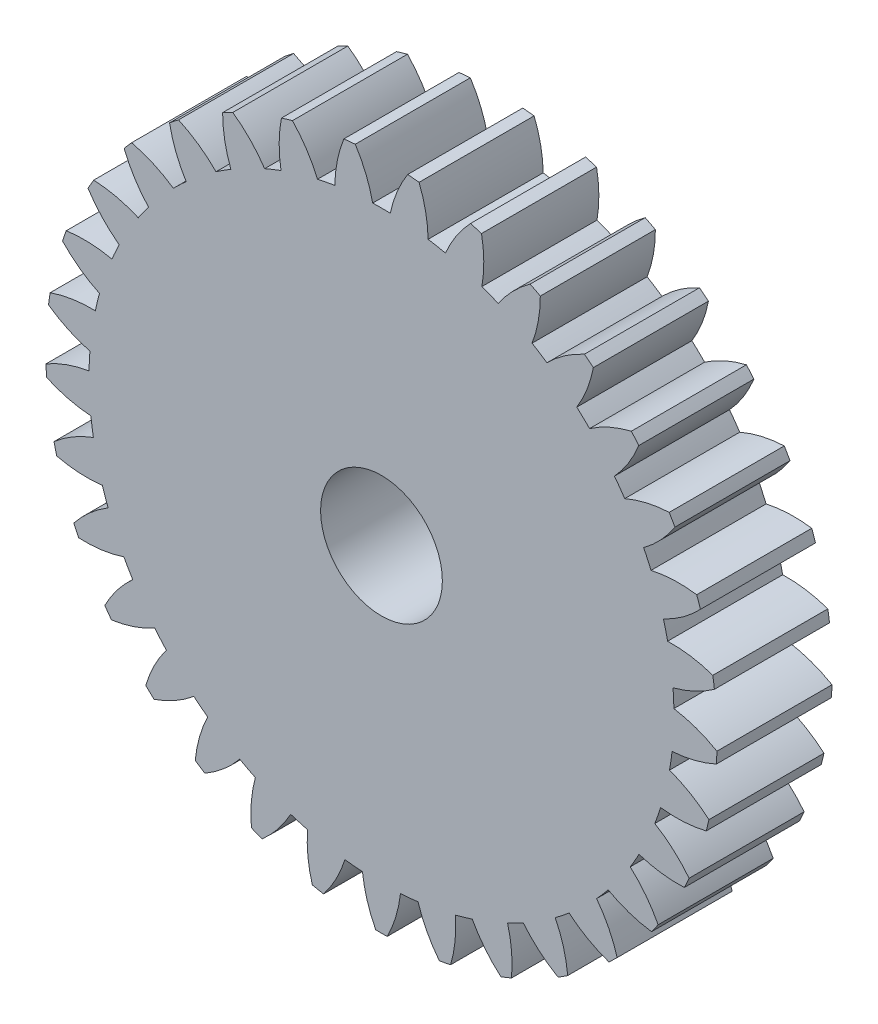
from build123d import *
from build123d.topology import SkipClean

# Parameters (mm, degrees)
CROQUIS1_R              = 3.175
SALIENTE_EXTRUIR1_DEPTH = 6
SALIENTE_EXTRUIR2_START = 5.5
CROQUIS2_R              = 6
CROQUIS2_R_2            = 3.175
SALIENTE_EXTRUIR2_DEPTH = 5.5


with BuildPart() as part:
    # Croquis1 → Saliente-Extruir1 (new body)
    with BuildSketch(Plane.XY):
        with BuildLine():
            ThreePointArc((2.432853295, 15.05367815), (2.30290802, 16.243278252), (1.96029505, 17.389860359))
            ThreePointArc((1.96029505, 17.389860359), (1.663480758, 17.420758645), (1.366182748, 17.446591206))
            ThreePointArc((1.366182748, 17.446591206), (0.812769149, 16.385569262), (0.460038855, 15.242059088))
            ThreePointArc((0.460038855, 15.242059088), (0, 15.249), (-0.460038855, 15.242059088))
            ThreePointArc((-0.460038855, 15.242059088), (-0.812769149, 16.385569262), (-1.366182748, 17.446591206))
            ThreePointArc((-1.366182748, 17.446591206), (-1.663480758, 17.420758645), (-1.96029505, 17.389860359))
            ThreePointArc((-1.96029505, 17.389860359), (-2.30290802, 16.243278252), (-2.432853295, 15.05367815))
            ThreePointArc((-2.432853295, 15.05367815), (-2.885892225, 14.973430705), (-3.336304003, 14.879552298))
            ThreePointArc((-3.336304003, 14.879552298), (-3.899070724, 15.935643106), (-4.643283141, 16.872756789))
            ThreePointArc((-4.643283141, 16.872756789), (-4.930319745, 16.791127038), (-5.215922677, 16.704614651))
            ThreePointArc((-5.215922677, 16.704614651), (-5.335352094, 15.513912845), (-5.237815789, 14.321218061))
            ThreePointArc((-5.237815789, 14.321218061), (-5.667480786, 14.156682611), (-6.091986431, 13.97925972))
            ThreePointArc((-6.091986431, 13.97925972), (-6.844449724, 14.909761289), (-7.752563184, 15.689096981))
            ThreePointArc((-7.752563184, 15.689096981), (-8.01896413, 15.554620351), (-8.283033268, 15.415620645))
            ThreePointArc((-8.283033268, 15.415620645), (-8.174962642, 14.223834206), (-7.853469973, 13.071151838))
            ThreePointArc((-7.853469973, 13.071151838), (-8.244231825, 12.828275122), (-8.627488597, 12.573720273))
            ThreePointArc((-8.627488597, 12.573720273), (-9.542452478, 13.345001851), (-10.581645394, 13.93839233))
            ThreePointArc((-10.581645394, 13.93839233), (-10.817782259, 13.755929158), (-11.050773456, 13.569465945))
            ThreePointArc((-11.050773456, 13.569465945), (-10.71910874, 12.41966914), (-10.18527929, 11.348660131))
            ThreePointArc((-10.18527929, 11.348660131), (-10.523014846, 11.036220347), (-10.851170847, 10.713733815))
            ThreePointArc((-10.851170847, 10.713733815), (-11.895566137, 11.297919277), (-13.02827937, 11.683917864))
            ThreePointArc((-13.02827937, 11.683917864), (-13.225617551, 11.460062844), (-13.419109899, 11.23287539))
            ThreePointArc((-13.419109899, 11.23287539), (-12.87583832, 10.166624871), (-12.148966076, 9.215998279))
            ThreePointArc((-12.148966076, 9.215998279), (-12.421468693, 8.845287814), (-12.68266351, 8.466525102))
            ThreePointArc((-12.68266351, 8.466525102), (-13.818743042, 8.842500464), (-15.004037384, 9.007156165))
            ThreePointArc((-15.004037384, 9.007156165), (-15.155444566, 8.75), (-15.302444747, 8.490299451))
            ThreePointArc((-15.302444747, 8.490299451), (-14.567201556, 7.546132291), (-13.673557575, 6.750246236))
            ThreePointArc((-13.673557575, 6.750246236), (-13.870978297, 6.334663533), (-14.055771669, 5.913314113))
            ThreePointArc((-14.055771669, 5.913314113), (-15.242474569, 6.067490645), (-16.437510395, 6.004852374))
            ThreePointArc((-16.437510395, 6.004852374), (-16.537514328, 5.723689358), (-16.632709371, 5.44086197))
            ThreePointArc((-16.632709371, 5.44086197), (-15.732068173, 4.652902829), (-14.703951076, 4.040522707))
            ThreePointArc((-14.703951076, 4.040522707), (-14.819154605, 3.595088008), (-14.920867618, 3.146380544))
            ThreePointArc((-14.920867618, 3.146380544), (-16.115303351, 3.073185905), (-17.276888952, 2.785517572))
            ThreePointArc((-17.276888952, 2.785517572), (-17.321875233, 2.49050967), (-17.361824543, 2.19477756))
            ThreePointArc((-17.361824543, 2.19477756), (-16.328336856, 1.591505335), (-15.202905475, 1.18476416))
            ThreePointArc((-15.202905475, 1.18476416), (-15.231728055, 0.725576634), (-15.246684535, 0.265728585))
            ThreePointArc((-15.246684535, 0.265728585), (-16.405683083, -0.03219178), (-17.491835728, -0.534493092))
            ThreePointArc((-17.491835728, -0.534493092), (-17.480178436, -0.832683527), (-17.46343814, -1.130631829))
            ThreePointArc((-17.46343814, -1.130631829), (-16.334456903, -1.527413308), (-15.152387259, -1.713814851))
            ThreePointArc((-15.152387259, -1.713814851), (-15.093787167, -2.170158969), (-15.021446549, -2.624527497))
            ThreePointArc((-15.021446549, -2.624527497), (-16.103118683, -3.136405971), (-17.074581986, -3.835185783))
            ThreePointArc((-17.074581986, -3.835185783), (-17.006702446, -4.125781371), (-16.933877582, -4.415177237))
            ThreePointArc((-16.933877582, -4.415177237), (-15.750207118, -4.591127255), (-14.554222289, -4.550452128))
            ThreePointArc((-14.554222289, -4.550452128), (-14.410317485, -4.987459373), (-14.253294346, -5.419926318))
            ThreePointArc((-14.253294346, -5.419926318), (-15.218545617, -6.127262278), (-16.040208364, -6.997264868))
            ThreePointArc((-16.040208364, -6.997264868), (-15.918559919, -7.269762728), (-15.792282567, -7.540146637))
            ThreePointArc((-15.792282567, -7.540146637), (-14.596703811, -7.4889059), (-13.430029804, -7.222624209))
            ThreePointArc((-13.430029804, -7.222624209), (-13.206021382, -7.6245), (-12.969990949, -8.01943488))
            ThreePointArc((-12.969990949, -8.01943488), (-13.783934661, -8.896663362), (-14.42609982, -9.906444569))
            ThreePointArc((-14.42609982, -9.906444569), (-14.255079161, -10.150995918), (-14.079913315, -10.392595492))
            ThreePointArc((-14.079913315, -10.392595492), (-12.915637597, -10.116015974), (-11.820441051, -9.633751832))
            ThreePointArc((-11.820441051, -9.633751832), (-11.524425259, -9.985971332), (-11.217918286, -10.32910017))
            ThreePointArc((-11.217918286, -10.32910017), (-11.851136393, -11.344515851), (-12.290594441, -12.457579552))
            ThreePointArc((-12.290594441, -12.457579552), (-12.076382701, -12.665345667), (-11.85865931, -12.869428868))
            ThreePointArc((-11.85865931, -12.869428868), (-10.767766589, -12.377506874), (-9.78363076, -11.696690564))
            ThreePointArc((-9.78363076, -11.696690564), (-9.426306381, -11.986523642), (-9.060400828, -12.265444869))
            ThreePointArc((-9.060400828, -12.265444869), (-9.490007178, -13.382347981), (-9.710874956, -14.558465152))
            ThreePointArc((-9.710874956, -14.558465152), (-9.461214305, -14.721936825), (-9.20880246, -14.881127553))
            ThreePointArc((-9.20880246, -14.881127553), (-8.230720441, -14.191642426), (-7.393214562, -13.336880424))
            ThreePointArc((-7.393214562, -13.336880424), (-6.98749623, -13.553851757), (-6.575416878, -13.758484433))
            ThreePointArc((-6.575416878, -13.758484433), (-6.785884378, -14.936507186), (-6.780179149, -16.13316989))
            ThreePointArc((-6.780179149, -16.13316989), (-6.504092974, -16.246438828), (-6.226115496, -16.354983517))
            ThreePointArc((-6.226115496, -16.354983517), (-5.396194611, -15.492855045), (-4.735588328, -14.495040676))
            ThreePointArc((-4.735588328, -14.495040676), (-4.296139759, -14.631308355), (-3.852780229, -14.754256522))
            ThreePointArc((-3.852780229, -14.754256522), (-3.836502035, -15.950822106), (-3.604430001, -17.124779834))
            ThreePointArc((-3.604430001, -17.124779834), (-3.311896776, -17.183752202), (-3.018400496, -17.237727764))
            ThreePointArc((-3.018400496, -17.237727764), (-2.366636249, -16.234115516), (-1.906805592, -15.129312391))
            ThreePointArc((-1.906805592, -15.129312391), (-1.449509604, -15.179951347), (-0.990894065, -15.216771338))
            ThreePointArc((-0.990894065, -15.216771338), (-0.748458514, -16.388632755), (-0.298407363, -17.497455616))
            ThreePointArc((-0.298407363, -17.497455616), (0, -17.5), (0.298407363, -17.497455616))
            ThreePointArc((0.298407363, -17.497455616), (0.748458514, -16.388632755), (0.990894065, -15.216771338))
            ThreePointArc((0.990894065, -15.216771338), (1.449509604, -15.179951347), (1.906805592, -15.129312391))
            ThreePointArc((1.906805592, -15.129312391), (2.366636249, -16.234115516), (3.018400496, -17.237727764))
            ThreePointArc((3.018400496, -17.237727764), (3.311896776, -17.183752202), (3.604430001, -17.124779834))
            ThreePointArc((3.604430001, -17.124779834), (3.836502035, -15.950822106), (3.852780229, -14.754256522))
            ThreePointArc((3.852780229, -14.754256522), (4.296139759, -14.631308355), (4.735588328, -14.495040676))
            ThreePointArc((4.735588328, -14.495040676), (5.396194611, -15.492855045), (6.226115496, -16.354983517))
            ThreePointArc((6.226115496, -16.354983517), (6.504092974, -16.246438828), (6.780179149, -16.13316989))
            ThreePointArc((6.780179149, -16.13316989), (6.785884378, -14.936507186), (6.575416878, -13.758484433))
            ThreePointArc((6.575416878, -13.758484433), (6.98749623, -13.553851757), (7.393214562, -13.336880424))
            ThreePointArc((7.393214562, -13.336880424), (8.230720441, -14.191642426), (9.20880246, -14.881127553))
            ThreePointArc((9.20880246, -14.881127553), (9.461214305, -14.721936825), (9.710874956, -14.558465152))
            ThreePointArc((9.710874956, -14.558465152), (9.490007178, -13.382347981), (9.060400828, -12.265444869))
            ThreePointArc((9.060400828, -12.265444869), (9.426306381, -11.986523642), (9.78363076, -11.696690564))
            ThreePointArc((9.78363076, -11.696690564), (10.767766589, -12.377506874), (11.85865931, -12.869428868))
            ThreePointArc((11.85865931, -12.869428868), (12.076382701, -12.665345667), (12.290594441, -12.457579552))
            ThreePointArc((12.290594441, -12.457579552), (11.851136393, -11.344515851), (11.217918286, -10.32910017))
            ThreePointArc((11.217918286, -10.32910017), (11.524425259, -9.985971332), (11.820441051, -9.633751832))
            ThreePointArc((11.820441051, -9.633751832), (12.915637597, -10.116015974), (14.079913315, -10.392595492))
            ThreePointArc((14.079913315, -10.392595492), (14.255079161, -10.150995918), (14.42609982, -9.906444569))
            ThreePointArc((14.42609982, -9.906444569), (13.783934661, -8.896663362), (12.969990949, -8.01943488))
            ThreePointArc((12.969990949, -8.01943488), (13.206021382, -7.6245), (13.430029804, -7.222624209))
            ThreePointArc((13.430029804, -7.222624209), (14.596703811, -7.4889059), (15.792282567, -7.540146637))
            ThreePointArc((15.792282567, -7.540146637), (15.918559919, -7.269762728), (16.040208364, -6.997264868))
            ThreePointArc((16.040208364, -6.997264868), (15.218545617, -6.127262278), (14.253294346, -5.419926318))
            ThreePointArc((14.253294346, -5.419926318), (14.410317485, -4.987459373), (14.554222289, -4.550452128))
            ThreePointArc((14.554222289, -4.550452128), (15.750207118, -4.591127255), (16.933877582, -4.415177237))
            ThreePointArc((16.933877582, -4.415177237), (17.006702446, -4.125781371), (17.074581986, -3.835185783))
            ThreePointArc((17.074581986, -3.835185783), (16.103118683, -3.136405971), (15.021446549, -2.624527497))
            ThreePointArc((15.021446549, -2.624527497), (15.093787167, -2.170158969), (15.152387259, -1.713814851))
            ThreePointArc((15.152387259, -1.713814851), (16.334456903, -1.527413308), (17.46343814, -1.130631829))
            ThreePointArc((17.46343814, -1.130631829), (17.480178436, -0.832683527), (17.491835728, -0.534493092))
            ThreePointArc((17.491835728, -0.534493092), (16.405683083, -0.03219178), (15.246684535, 0.265728585))
            ThreePointArc((15.246684535, 0.265728585), (15.231728055, 0.725576634), (15.202905475, 1.18476416))
            ThreePointArc((15.202905475, 1.18476416), (16.328336856, 1.591505335), (17.361824543, 2.19477756))
            ThreePointArc((17.361824543, 2.19477756), (17.321875233, 2.49050967), (17.276888952, 2.785517572))
            ThreePointArc((17.276888952, 2.785517572), (16.115303351, 3.073185905), (14.920867618, 3.146380544))
            ThreePointArc((14.920867618, 3.146380544), (14.819154605, 3.595088008), (14.703951076, 4.040522707))
            ThreePointArc((14.703951076, 4.040522707), (15.732068173, 4.652902829), (16.632709371, 5.44086197))
            ThreePointArc((16.632709371, 5.44086197), (16.537514328, 5.723689358), (16.437510395, 6.004852374))
            ThreePointArc((16.437510395, 6.004852374), (15.242474569, 6.067490645), (14.055771669, 5.913314113))
            ThreePointArc((14.055771669, 5.913314113), (13.870978297, 6.334663533), (13.673557575, 6.750246236))
            ThreePointArc((13.673557575, 6.750246236), (14.567201556, 7.546132291), (15.302444747, 8.490299451))
            ThreePointArc((15.302444747, 8.490299451), (15.155444566, 8.75), (15.004037384, 9.007156165))
            ThreePointArc((15.004037384, 9.007156165), (13.818743042, 8.842500464), (12.68266351, 8.466525102))
            ThreePointArc((12.68266351, 8.466525102), (12.421468693, 8.845287814), (12.148966076, 9.215998279))
            ThreePointArc((12.148966076, 9.215998279), (12.87583832, 10.166624871), (13.419109899, 11.23287539))
            ThreePointArc((13.419109899, 11.23287539), (13.225617551, 11.460062844), (13.02827937, 11.683917864))
            ThreePointArc((13.02827937, 11.683917864), (11.895566137, 11.297919277), (10.851170847, 10.713733815))
            ThreePointArc((10.851170847, 10.713733815), (10.523014846, 11.036220347), (10.18527929, 11.348660131))
            ThreePointArc((10.18527929, 11.348660131), (10.71910874, 12.41966914), (11.050773456, 13.569465945))
            ThreePointArc((11.050773456, 13.569465945), (10.817782259, 13.755929158), (10.581645394, 13.93839233))
            ThreePointArc((10.581645394, 13.93839233), (9.542452478, 13.345001851), (8.627488597, 12.573720273))
            ThreePointArc((8.627488597, 12.573720273), (8.244231825, 12.828275122), (7.853469973, 13.071151838))
            ThreePointArc((7.853469973, 13.071151838), (8.174962642, 14.223834206), (8.283033268, 15.415620645))
            ThreePointArc((8.283033268, 15.415620645), (8.01896413, 15.554620351), (7.752563184, 15.689096981))
            ThreePointArc((7.752563184, 15.689096981), (6.844449724, 14.909761289), (6.091986431, 13.97925972))
            ThreePointArc((6.091986431, 13.97925972), (5.667480786, 14.156682611), (5.237815789, 14.321218061))
            ThreePointArc((5.237815789, 14.321218061), (5.335352094, 15.513912845), (5.215922677, 16.704614651))
            ThreePointArc((5.215922677, 16.704614651), (4.930319745, 16.791127038), (4.643283141, 16.872756789))
            ThreePointArc((4.643283141, 16.872756789), (3.899070724, 15.935643106), (3.336304003, 14.879552298))
            ThreePointArc((3.336304003, 14.879552298), (2.885892225, 14.973430705), (2.432853295, 15.05367815))
        make_face()
        Circle(CROQUIS1_R, mode=Mode.SUBTRACT)
    extrude(amount=SALIENTE_EXTRUIR1_DEPTH)

    # Croquis2 → Saliente-Extruir2 (add)
    with SkipClean():  # the faces are left unmerged after this step: merging them gives an invalid solid
        with BuildSketch(Plane(origin=(0, 0, 0), x_dir=(-1, 0, 0), z_dir=(0, 0, -1)).offset(SALIENTE_EXTRUIR2_START)):
            with Locations(Location((0, 0, 0), (0, 0, 180))):
                Circle(CROQUIS2_R)
            Circle(CROQUIS2_R_2, mode=Mode.SUBTRACT)
        extrude(amount=-SALIENTE_EXTRUIR2_DEPTH)


solid = part.part
